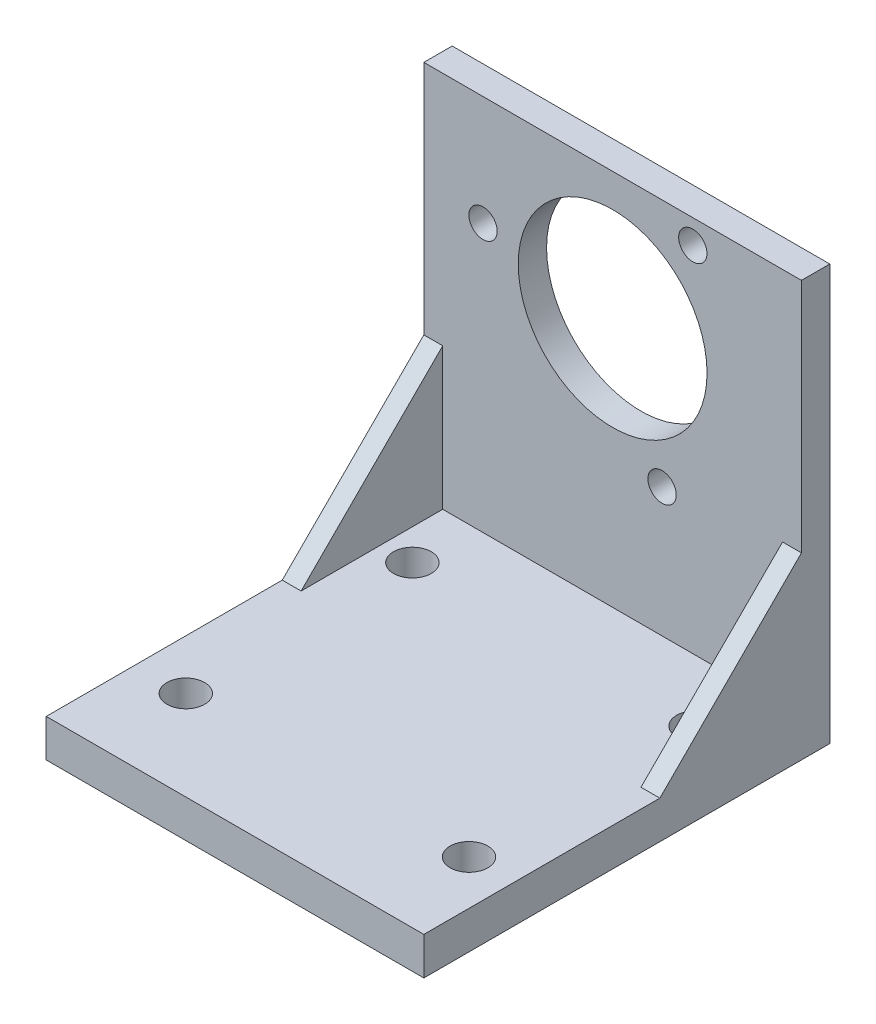
from build123d import *

# Parameters (mm, degrees)
SKETCH1_W           = 40
SKETCH1_H           = 43
SKETCH1_R           = 2
BOSS_EXTRUDE1_DEPTH = 4
SKETCH4_W           = 40
SKETCH4_H           = 3
BOSS_EXTRUDE2_DEPTH = 40
SKETCH5_R           = 1.5
SKETCH5_R_2         = 10
CUT_EXTRUDE1_DEPTH  = 24
BOSS_EXTRUDE3_DEPTH = 2
BOSS_EXTRUDE4_DEPTH = 2


with BuildPart() as part:
    # Sketch1 → Boss-Extrude1 (new body)
    with BuildSketch(Plane(origin=(0, 0, 0), x_dir=(1, 0, 0), z_dir=(0, 1, 0))):
        Rectangle(SKETCH1_W, SKETCH1_H)
        with Locations(Location((-14.715053003, 12, 0), (0, 0, 270))):
            Circle(SKETCH1_R, mode=Mode.SUBTRACT)
        with Locations(Location((15.284946997, 12, 0), (0, 0, 270))):
            Circle(SKETCH1_R, mode=Mode.SUBTRACT)
        with Locations(Location((-14.715053003, -12, 0), (0, 0, 270))):
            Circle(SKETCH1_R, mode=Mode.SUBTRACT)
        with Locations(Location((15.284946997, -12, 0), (0, 0, 270))):
            Circle(SKETCH1_R, mode=Mode.SUBTRACT)
    extrude(amount=-BOSS_EXTRUDE1_DEPTH)

    # Sketch4 → Boss-Extrude2 (add)
    with BuildSketch(Plane(origin=(0, 0, 0), x_dir=(1, 0, 0), z_dir=(0, 1, 0))):
        with Locations((0, 20)):
            Rectangle(SKETCH4_W, SKETCH4_H)
    extrude(amount=BOSS_EXTRUDE2_DEPTH)

    # Sketch5 → Cut-Extrude1 (cut)
    with BuildSketch(Plane.XY.offset(-18.5)):
        with Locations((8.491960292, 37.449274423)):
            Circle(SKETCH5_R)
        with Locations((-13.72832995, 28.379616129)):
            Circle(SKETCH5_R)
        with Locations((5.236369657, 13.671109447)):
            Circle(SKETCH5_R)
        with Locations((0, 26.5)):
            Circle(SKETCH5_R_2)
    extrude(amount=-CUT_EXTRUDE1_DEPTH, mode=Mode.SUBTRACT)

    # Sketch6 → Boss-Extrude3 (add)
    with BuildSketch(Plane(origin=(20, 0, 0), x_dir=(0, 0, -1), z_dir=(1, 0, 0))):
        Polygon((18.5, 15), (3.5, 0), (18.5, 0), align=None)
    extrude(amount=-BOSS_EXTRUDE3_DEPTH)

    # Sketch7 → Boss-Extrude4 (add)
    with BuildSketch(Plane.ZY.offset(20)):
        Polygon((-18.5, 15), (-3.5, 0), (-18.5, 0), align=None)
    extrude(amount=-BOSS_EXTRUDE4_DEPTH)


solid = part.part
